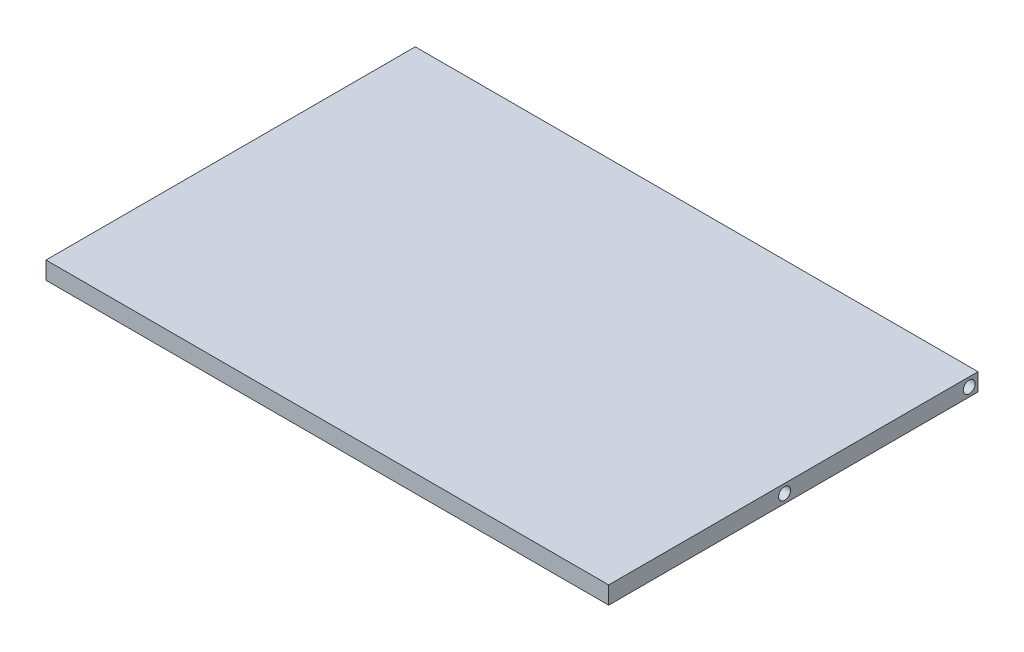
from build123d import *

# Parameters (mm, degrees)
SKETCH_1_W          = 160
SKETCH_1_H          = 105
EXTRUDE_1_DEPTH     = 5
SKETCH_2_R          = 1.7
CUT_EXTRUDE_1_DEPTH = 200
SKETCH_3_R          = 1.7
CUT_EXTRUDE_2_DEPTH = 200


with BuildPart() as part:
    # 草图1 → 凸台-拉伸1 (new body)
    with BuildSketch(Plane(origin=(0, 0, 0), x_dir=(1, 0, 0), z_dir=(0, 1, 0))):
        Rectangle(SKETCH_1_W, SKETCH_1_H)
    extrude(amount=EXTRUDE_1_DEPTH)

    # 草图2 → 切除-拉伸1 (cut)
    with BuildSketch(Plane(origin=(80, 0, 0), x_dir=(0, 0, -1), z_dir=(1, 0, 0))):
        with Locations((-2.5, 2.5)):
            Circle(SKETCH_2_R)
    extrude(amount=-CUT_EXTRUDE_1_DEPTH, mode=Mode.SUBTRACT)

    # 草图3 → 切除-拉伸2 (cut)
    with BuildSketch(Plane(origin=(80, 0, 0), x_dir=(0, 0, -1), z_dir=(1, 0, 0))):
        with Locations((50, 2.5)):
            Circle(SKETCH_3_R)
    extrude(amount=-CUT_EXTRUDE_2_DEPTH, mode=Mode.SUBTRACT)


solid = part.part
